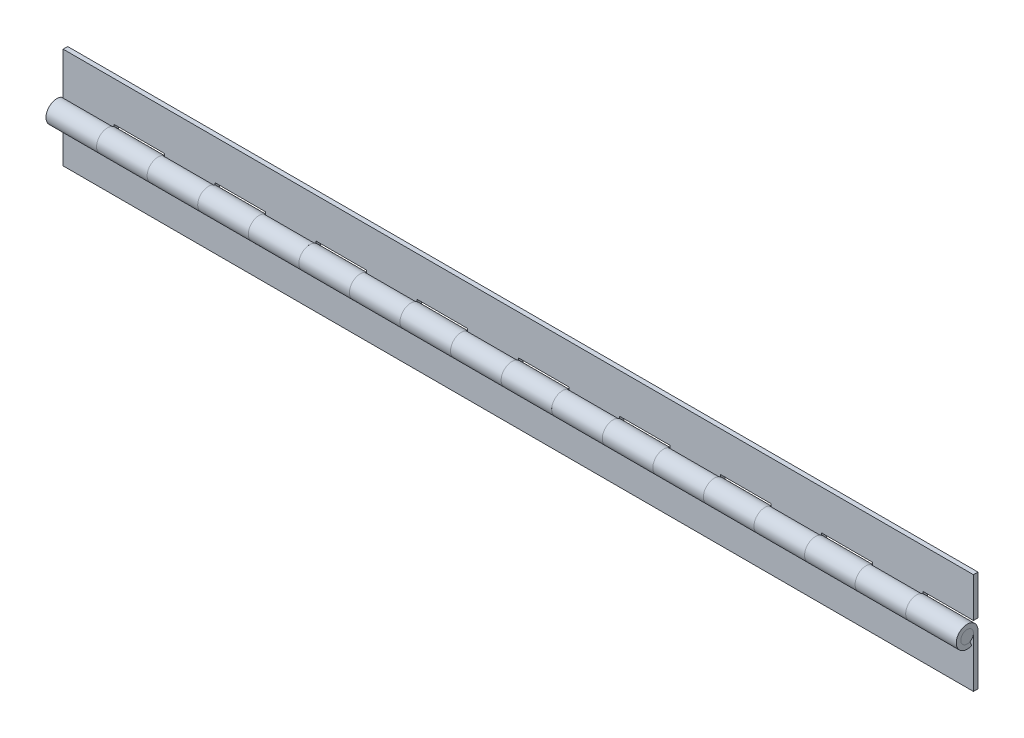
from build123d import *

# Parameters (mm, degrees)
BOSS_EXTRUDE1_DEPTH     = 304.8
SKETCH4_W               = 25.4
SKETCH4_H               = 10.922
CUT_EXTRUDE1_DEPTH      = 306.905250888
LPATTERN1_COUNT         = 12
LPATTERN1_PITCH         = 50.8
BOSS_EXTRUDE2_DEPTH     = 609.6
SKETCH6_W               = 25.4
SKETCH6_H               = 10.922
CUT_EXTRUDE2_DEPTH      = 306.905250888
LPATTERN2_COUNT         = 12
LPATTERN2_PITCH         = 50.8
SKETCH7_R               = 3.175
BOSS_EXTRUDE3_DEPTH     = 609.6
CHAMFER1_SIZE           = 0.635
CUT_EXTRUDE3_DEPTH      = 306.905250888
CUT_EXTRUDE3_DEPTH_BACK = 306.905250888
SKETCH8_OUTSIDE_W       = 733.962
SKETCH8_OUTSIDE_H       = 175.162
SKETCH8_OUTSIDE_W_2     = 457.2
SKETCH8_OUTSIDE_H_2     = 50.8


with BuildPart() as part:
    # Sketch3 → Boss-Extrude1 (new, symmetric)
    with BuildSketch(Plane(origin=(0, 0, 0), x_dir=(0, 0, -1), z_dir=(1, 0, 0))):
        with BuildLine():
            Line((1.341812981, -2.877527224), (2.307918327, -4.949346825))
            ThreePointArc((2.307918327, -4.949346825), (-4.605760686, 2.934193161), (5.461, 0))
            Line((5.461, 0), (5.461, -25.4))
            Line((5.461, -25.4), (3.175, -25.4))
            Line((3.175, -25.4), (3.175, -4.443185344))
            Line((3.175, -4.443185344), (3.175, 0))
            ThreePointArc((3.175, 0), (-2.67776784, 1.705926257), (1.341812981, -2.877527224))
        make_face()
    extrude(amount=BOSS_EXTRUDE1_DEPTH, both=True)

    # Sketch4 → Cut-Extrude1 (cut, symmetric)
    with BuildSketch(Plane.XY):
        with Locations((292.1, 0)):
            Rectangle(SKETCH4_W, SKETCH4_H)
    cut_extrude1 = extrude(amount=CUT_EXTRUDE1_DEPTH, both=True, mode=Mode.SUBTRACT)

    # LPattern1: Cut-Extrude1 ×12
    with Locations(*[(-i * LPATTERN1_PITCH, 0, 0) for i in range(1, LPATTERN1_COUNT)]):
        add(cut_extrude1, mode=Mode.SUBTRACT)


with BuildPart() as body_2:
    # Sketch5 → Boss-Extrude2 (new body)
    with BuildSketch(Plane(origin=(304.8, 0, 0), x_dir=(0, 0, -1), z_dir=(1, 0, 0))):
        with BuildLine():
            Line((3.175, 25.4), (3.175, 4.443185344))
            Line((3.175, 4.443185344), (3.175, 0))
            ThreePointArc((3.175, 0), (-2.67776784, -1.705926257), (1.341812981, 2.877527224))
            Line((1.341812981, 2.877527224), (2.307918327, 4.949346825))
            ThreePointArc((2.307918327, 4.949346825), (-4.605760686, -2.934193161), (5.461, 0))
            Line((5.461, 0), (5.461, 25.4))
            Line((5.461, 25.4), (3.175, 25.4))
        make_face()
    extrude(amount=-BOSS_EXTRUDE2_DEPTH)

    # Sketch6 → Cut-Extrude2 (cut, symmetric)
    with BuildSketch(Plane.XY):
        with Locations((266.7, 0)):
            Rectangle(SKETCH6_W, SKETCH6_H)
    cut_extrude2 = extrude(amount=CUT_EXTRUDE2_DEPTH, both=True, mode=Mode.SUBTRACT)

    # LPattern2: Cut-Extrude2 ×12
    with Locations(*[(-i * LPATTERN2_PITCH, 0, 0) for i in range(1, LPATTERN2_COUNT)]):
        add(cut_extrude2, mode=Mode.SUBTRACT)


with BuildPart() as body_3:
    # Sketch7 → Boss-Extrude3 (new body)
    with BuildSketch(Plane(origin=(304.8, 0, 0), x_dir=(0, 0, -1), z_dir=(1, 0, 0))):
        Circle(SKETCH7_R)
    extrude(amount=-BOSS_EXTRUDE3_DEPTH)

    # Chamfer1
    chamfer1_edges = [body_3.edges().sort_by_distance(p)[0] for p in [
        (304.8, 0, 3.175),
        (-304.8, 0, 3.175),
    ]]
    chamfer(chamfer1_edges, length=CHAMFER1_SIZE)


with BuildPart() as cut_extrude3_tool:
    # Sketch8 outside → Cut-Extrude3 (new, two sides: drawn at the far end of the back side and taken through both)
    with BuildSketch(Plane.XY.offset(-CUT_EXTRUDE3_DEPTH_BACK)):
        Rectangle(SKETCH8_OUTSIDE_W, SKETCH8_OUTSIDE_H)
        Rectangle(SKETCH8_OUTSIDE_W_2, SKETCH8_OUTSIDE_H_2, mode=Mode.SUBTRACT)
    extrude(amount=CUT_EXTRUDE3_DEPTH + CUT_EXTRUDE3_DEPTH_BACK)


with BuildPart() as part_1:
    add(part.part)

    # Cut-Extrude3: cut by cut_extrude3_tool
    add(cut_extrude3_tool.part, mode=Mode.SUBTRACT)


with BuildPart() as body_2_1:
    add(body_2.part)

    # Cut-Extrude3: cut by cut_extrude3_tool
    add(cut_extrude3_tool.part, mode=Mode.SUBTRACT)


with BuildPart() as body_3_1:
    add(body_3.part)

    # Cut-Extrude3: cut by cut_extrude3_tool
    add(cut_extrude3_tool.part, mode=Mode.SUBTRACT)


solid = Compound([part_1.part, body_2_1.part, body_3_1.part])
